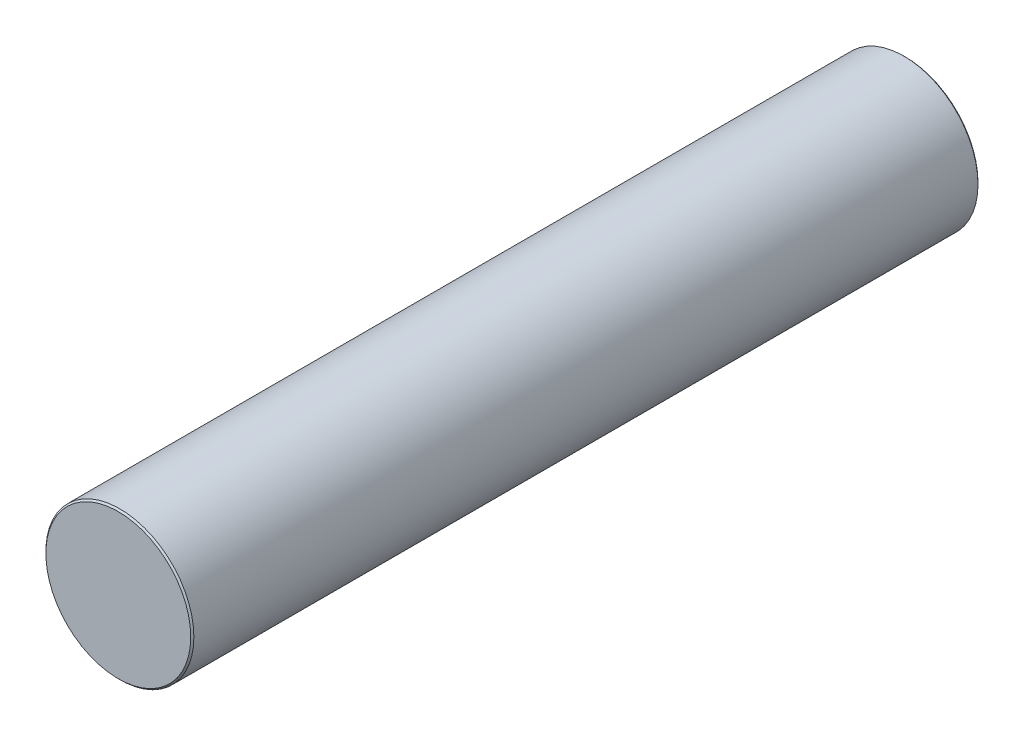
from build123d import *

# Parameters (mm, degrees)
SKETCH2_R           = 2.35
BOSS_EXTRUDE1_DEPTH = 25
CHAMFER2_SIZE       = 0.05


with BuildPart() as part:
    # Sketch2 → Boss-Extrude1 (new body)
    with BuildSketch(Plane.XY):
        Circle(SKETCH2_R)
    extrude(amount=BOSS_EXTRUDE1_DEPTH)

    # Chamfer2
    chamfer2_edges = [part.edges().sort_by_distance(p)[0] for p in [
        (-2.35, 0, 0),
        (-2.35, 0, 25),
    ]]
    chamfer(chamfer2_edges, length=CHAMFER2_SIZE)


solid = part.part
